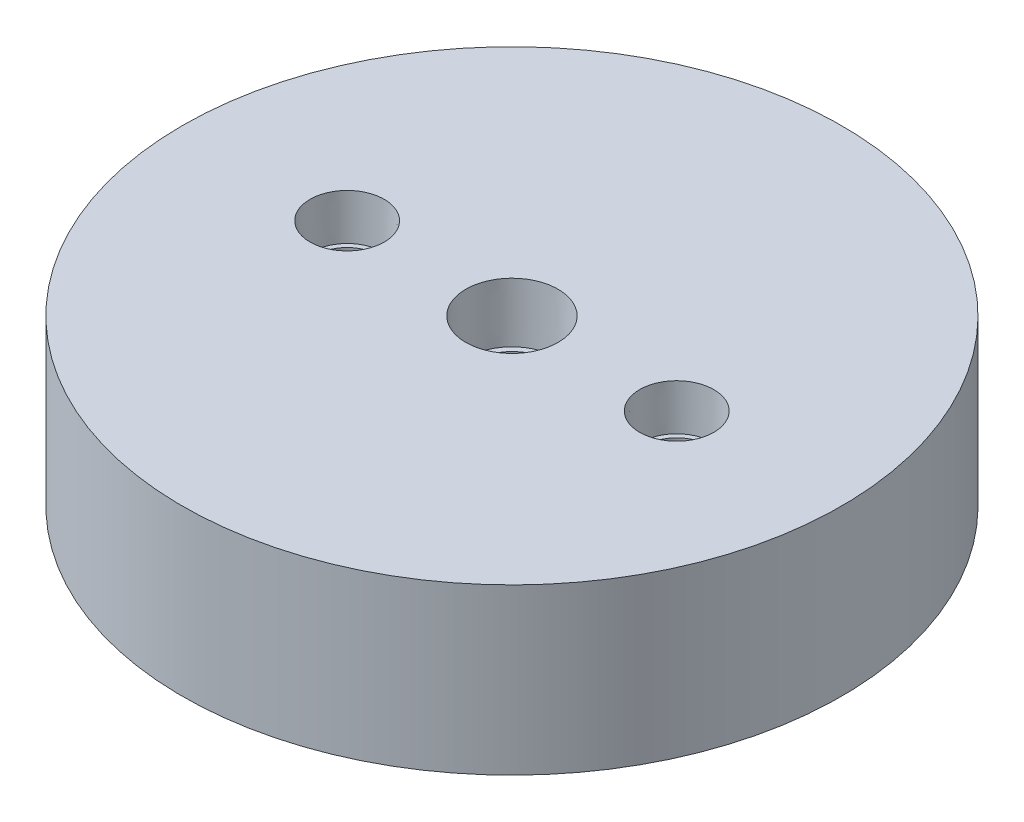
from build123d import *

# Parameters (mm, degrees)
F_3_8_NPT_TAPPED_HOLE1_AT_2_COUNT = 2
F_3_8_NPT_TAPPED_HOLE1_AT_2_PITCH = 76.2


with BuildPart() as part:
    # Sketch1 → Revolve1 (revolve)
    with BuildSketch(Plane.XY):
        Polygon((0, 0), (-76.2, 0), (-76.2, -38.1), (-60.96, -38.1), (-60.96, -25.4), (-28.575, -25.4), (-28.575, -20.32), (-22.225, -20.32), (0, -15.85722), align=None)
    revolve(axis=Axis((0, 0, 0), (0, -1, 0)))

    # Sketch3 → 1/2 NPT Tapped Hole1 (revolve, cut)
    with BuildSketch(Plane(origin=(0, 0, 0), x_dir=(0, 0, 1), z_dir=(1, 0, 0))):
        Polygon((0, 0), (0, 38.1), (8.9281, 38.1), (8.9281, 13.462), (10.261665792, 13.462), (10.6647361, 0), align=None)
    revolve(axis=Axis((0, 6.35, 0), (0, -1, 0)), mode=Mode.SUBTRACT)

    # Sketch5 → 3/8 NPT Tapped Hole1 (revolve, cut)
    with BuildSketch(Plane(origin=(-38.1, 0, 0), x_dir=(0, 0, 1), z_dir=(1, 0, 0))):
        Polygon((0, 0), (0, 38.1), (7.1374, 38.1), (7.1374, 10.414), (8.263205494, 10.414), (8.5750146, 0), align=None)
    f_3_8_npt_tapped_hole1 = revolve(axis=Axis((-38.1, 6.35, 0), (0, -1, 0)), mode=Mode.SUBTRACT)

    # 3/8 NPT Tapped Hole1 at 2: 3/8 NPT Tapped Hole1 ×2
    with Locations(*[(i * F_3_8_NPT_TAPPED_HOLE1_AT_2_PITCH, 0, 0) for i in range(1, F_3_8_NPT_TAPPED_HOLE1_AT_2_COUNT)]):
        add(f_3_8_npt_tapped_hole1, mode=Mode.SUBTRACT)


solid = part.part
